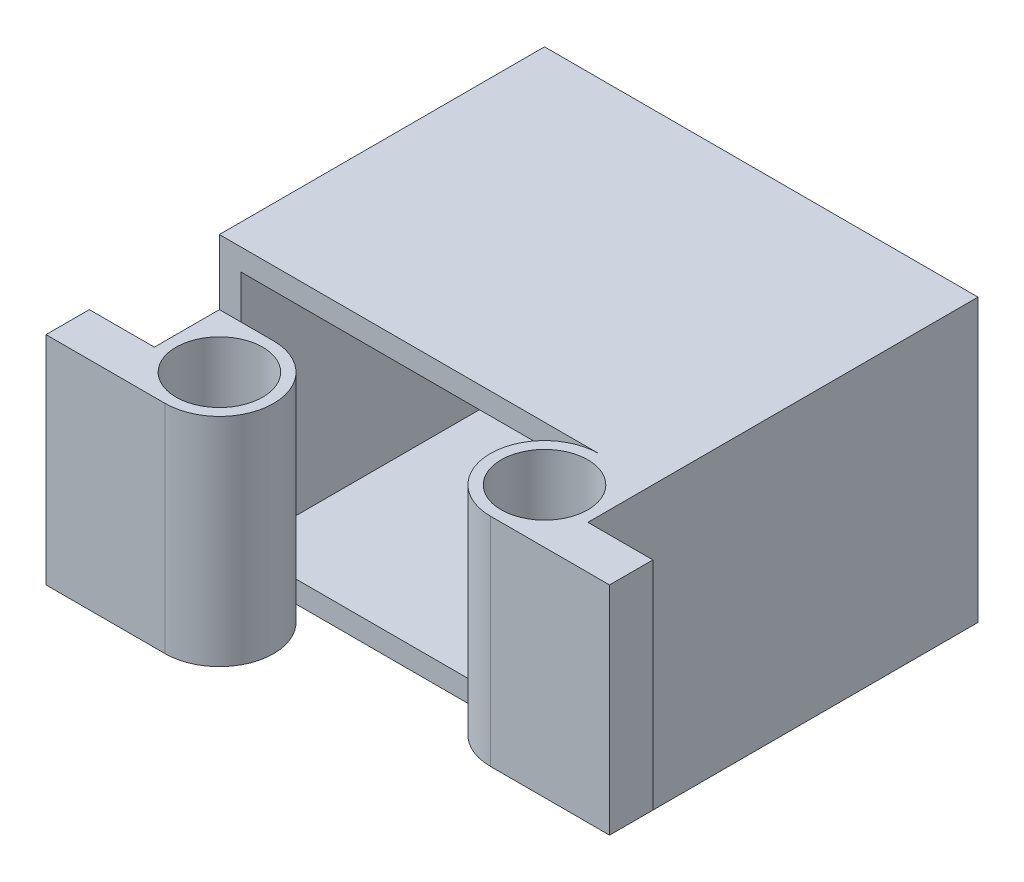
from build123d import *

# Parameters (mm, degrees)
SKETCH_1_W          = 20
SKETCH_1_H          = 13
EXTRUDE_1_DEPTH     = 15
SHELL_1_T           = -1
SKETCH_2_R          = 2.5
SKETCH_2_R_2        = 2
EXTRUDE_4_DEPTH     = 10
SKETCH_3_R          = 4.9
CUT_EXTRUDE_1_DEPTH = 0.2
SKETCH_9_R          = 2.5
SKETCH_9_R_2        = 2
EXTRUDE_8_DEPTH     = 10
SKETCH_6_W          = 2
SKETCH_6_H          = 10
EXTRUDE_10_DEPTH    = 3
SKETCH_10_W         = 2
SKETCH_10_H         = 10
EXTRUDE_11_DEPTH    = 3


with BuildPart() as part:
    # 스케치1 → 보스-돌출1 (new body)
    with BuildSketch(Plane.XY):
        Rectangle(SKETCH_1_W, SKETCH_1_H)
    extrude(amount=EXTRUDE_1_DEPTH)

    # 쉘1
    shell_1_openings = [part.faces().sort_by_distance(p)[0] for p in [
        (0, 0, 15),
    ]]
    offset(amount=SHELL_1_T, openings=shell_1_openings, kind=Kind.INTERSECTION)

    # 스케치3 → 컷-돌출1 (cut)
    with BuildSketch(Plane.XY.offset(1)):
        with BuildLine():
            Line((4.9, 4.9), (2.1e-08, 4.9))
            ThreePointArc((2.1e-08, 4.9), (3.464823235, 3.46482322), (4.9, 0))
            Line((4.9, 0), (4.9, 4.9))
        make_face()
        with BuildLine():
            Line((2.1e-08, 4.9), (-4.9, 4.9))
            Line((-4.9, 4.9), (-4.9, 7e-09))
            ThreePointArc((-4.9, 7e-09), (-3.464823218, 3.464823238), (2.1e-08, 4.9))
        make_face()
        Circle(SKETCH_3_R)
        with BuildLine():
            ThreePointArc((0, -4.9), (-3.46482323, -3.464823225), (-4.9, 7e-09))
            Line((-4.9, 7e-09), (-4.9, -4.9))
            Line((-4.9, -4.9), (0, -4.9))
        make_face()
        with BuildLine():
            Line((4.9, -4.9), (4.9, 0))
            ThreePointArc((4.9, 0), (3.464823228, -3.464823228), (0, -4.9))
            Line((0, -4.9), (4.9, -4.9))
        make_face()
    extrude(amount=-CUT_EXTRUDE_1_DEPTH, mode=Mode.SUBTRACT)

    # 스케치9 → 보스-돌출8 (add)
    # profile 1 of 3: a face of its own
    with BuildSketch(Plane(origin=(0, 6.5, 0), x_dir=(1, 0, 0), z_dir=(0, 1, 0))):
        with BuildLine():
            Line((10, -17.5), (10, -15))
            Line((10, -15), (7.5, -15))
            ThreePointArc((7.5, -15), (9.267766953, -15.732233047), (10, -17.5))
        make_face()
    # profile 2 of 3: a face of its own
    with BuildSketch(Plane(origin=(0, 6.5, 0), x_dir=(1, 0, 0), z_dir=(0, 1, 0))):
        with BuildLine():
            Line((10, -20), (10, -17.5))
            ThreePointArc((10, -17.5), (9.267766953, -19.267766953), (7.5, -20))
            Line((7.5, -20), (10, -20))
        make_face()
    # profile 3 of 3: a face of its own
    with BuildSketch(Plane(origin=(0, 6.5, 0), x_dir=(1, 0, 0), z_dir=(0, 1, 0))):
        with Locations((7.5, -17.5)):
            Circle(SKETCH_9_R)
        with Locations(Location((7.5, -17.5, 0), (0, 0, 270))):
            Circle(SKETCH_9_R_2, mode=Mode.SUBTRACT)
    extrude(amount=-EXTRUDE_8_DEPTH)


with BuildPart() as body_2:
    # 스케치2 → 보스-돌출4 (new body)
    # profile 1 of 3: a face of its own
    with BuildSketch(Plane(origin=(0, 3.5, 0), x_dir=(1, 0, 0), z_dir=(0, 1, 0))):
        with BuildLine():
            ThreePointArc((-7.5, -20), (-9.267766953, -19.267766953), (-10, -17.5))
            Line((-10, -17.5), (-10, -20))
            Line((-10, -20), (-7.5, -20))
        make_face()
    # profile 2 of 3: a face of its own
    with BuildSketch(Plane(origin=(0, 3.5, 0), x_dir=(1, 0, 0), z_dir=(0, 1, 0))):
        with Locations((-7.5, -17.5)):
            Circle(SKETCH_2_R)
        with Locations(Location((-7.5, -17.5, 0), (0, 0, 270))):
            Circle(SKETCH_2_R_2, mode=Mode.SUBTRACT)
    # profile 3 of 3: a face of its own
    with BuildSketch(Plane(origin=(0, 3.5, 0), x_dir=(1, 0, 0), z_dir=(0, 1, 0))):
        with BuildLine():
            Line((-7.5, -15), (-10, -15))
            Line((-10, -15), (-10, -17.5))
            ThreePointArc((-10, -17.5), (-9.267766953, -15.732233047), (-7.5, -15))
        make_face()
    extrude(amount=-EXTRUDE_4_DEPTH)


    add(part.part)  # 보스-돌출10 merges part
    # 스케치6 → 보스-돌출10 (add)
    with BuildSketch(Plane.ZY.offset(10)):
        with Locations((19, -1.5)):
            Rectangle(SKETCH_6_W, SKETCH_6_H)
    extrude(amount=EXTRUDE_10_DEPTH)

    # 스케치10 → 보스-돌출11 (add)
    with BuildSketch(Plane(origin=(10, 0, 0), x_dir=(0, 0, -1), z_dir=(1, 0, 0))):
        with Locations((-19, 1.5)):
            Rectangle(SKETCH_10_W, SKETCH_10_H)
    extrude(amount=EXTRUDE_11_DEPTH)


solid = body_2.part
